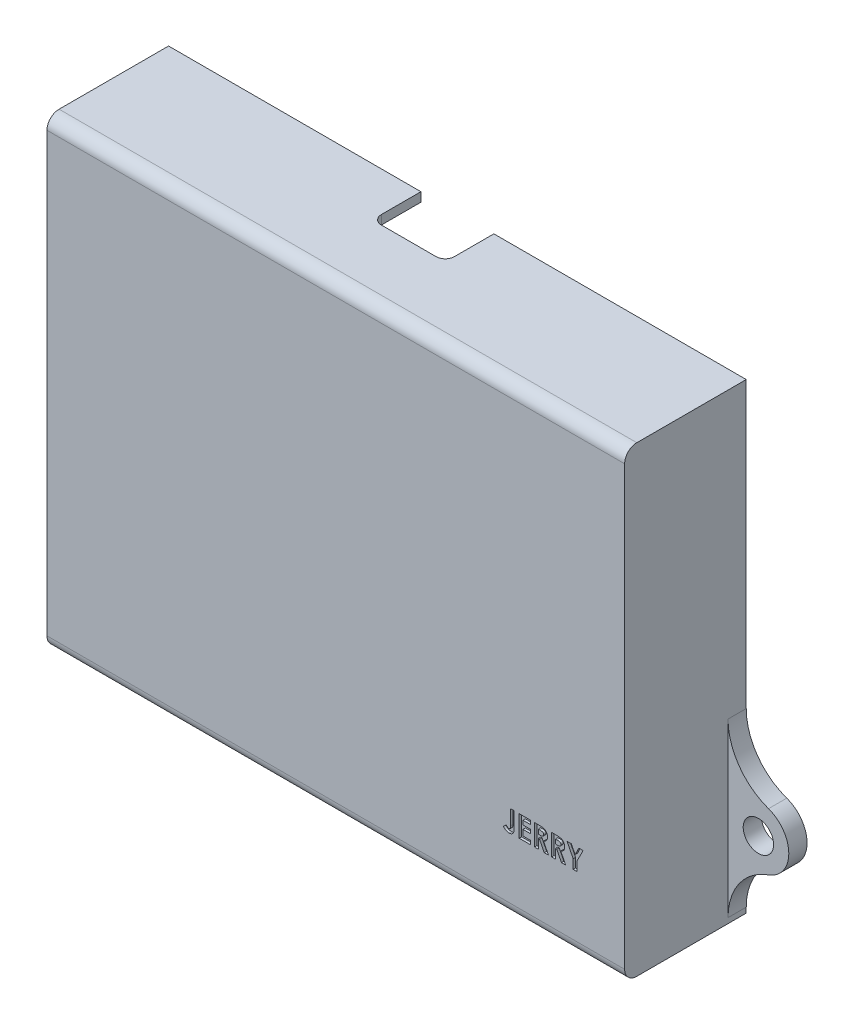
from build123d import *

# Parameters (mm, degrees)
SKETCH3_R             = 2.5
BOSS_EXTRUDE1_DEPTH   = 3
SKETCH3_R_2           = 3.85
BOSS_EXTRUDE1_2_DEPTH = 3
BOSS_EXTRUDE2_DEPTH   = 20
BOSS_EXTRUDE3_START   = 20
SKETCH3_4_W           = 84
SKETCH3_4_H           = 70
SKETCH3_4_W_2         = 8
SKETCH3_4_R           = 2.35
BOSS_EXTRUDE3_DEPTH   = 1.5
FILLET1_R             = 2
SKETCH4_W             = 30
SKETCH4_H             = 8
CUT_EXTRUDE1_DEPTH    = 4.5
CUT_EXTRUDE2_DEPTH    = 1.5
SKETCH6_W             = 12
SKETCH6_H             = 8
CUT_EXTRUDE3_DEPTH    = 1.5
FILLET2_R             = 1.5
CUT_EXTRUDE4_DEPTH    = 0.4


with BuildPart() as part:
    # Sketch3 → Boss-Extrude1 (new body)
    with BuildSketch(Plane.XY):
        with BuildLine():
            ThreePointArc((54.166666667, 20.285954792), (49.335034191, 16.631367068), (47.5, 10.857864376))
            Line((47.5, 10.857864376), (47.5, 39.142135624))
            ThreePointArc((47.5, 39.142135624), (49.335034191, 33.368632932), (54.166666667, 29.714045208))
            ThreePointArc((54.166666667, 29.714045208), (57.5, 25), (54.166666667, 20.285954792))
        make_face()
        with Locations((52.5, 25)):
            Circle(SKETCH3_R, mode=Mode.SUBTRACT)
    extrude(amount=BOSS_EXTRUDE1_DEPTH)



with BuildPart() as body_2:
    # Sketch3 → Boss-Extrude1 2 (new body)
    with BuildSketch(Plane.XY):
        with BuildLine():
            Line((-47.5, 39.142135624), (-47.5, 10.857864376))
            ThreePointArc((-47.5, 10.857864376), (-49.335034191, 16.631367068), (-54.166666667, 20.285954792))
            ThreePointArc((-54.166666667, 20.285954792), (-57.5, 25), (-54.166666667, 29.714045208))
            ThreePointArc((-54.166666667, 29.714045208), (-49.335034191, 33.368632932), (-47.5, 39.142135624))
        make_face()
        with Locations((-52.5, 25)):
            Circle(SKETCH3_R_2, mode=Mode.SUBTRACT)
    extrude(amount=BOSS_EXTRUDE1_2_DEPTH)


with BuildPart() as part_1:
    add(part.part)

    add(body_2.part)  # Boss-Extrude2 merges body 2
    # Sketch3<3> → Boss-Extrude2 (add)
    with BuildSketch(Plane.XY):
        Polygon((-38, 86), (-47.5, 86), (-47.5, 39.142135624), (-47.5, 10.857864376), (-47.5, 10), (-38, 10), (-38, 14.5), (-46, 14.5), (-46, 84.5), (-38, 84.5), align=None)
        Polygon((47.5, 86), (-38, 86), (-38, 84.5), (46, 84.5), (46, 14.5), (-38, 14.5), (-38, 10), (47.5, 10), (47.5, 10.857864376), (47.5, 39.142135624), align=None)
    extrude(amount=BOSS_EXTRUDE2_DEPTH)

    # Sketch3<4> → Boss-Extrude3 (add)
    # profile 1 of 4: a face of its own
    with BuildSketch(Plane.XY.offset(BOSS_EXTRUDE3_START)):
        with Locations((4, 49.5)):
            Rectangle(SKETCH3_4_W, SKETCH3_4_H)
    # profile 2 of 4: a face of its own
    with BuildSketch(Plane.XY.offset(BOSS_EXTRUDE3_START)):
        with Locations((-42, 49.5)):
            Rectangle(SKETCH3_4_W_2, SKETCH3_4_H)
        with Locations((-41.5, 21)):
            Circle(SKETCH3_4_R, mode=Mode.SUBTRACT)
        with Locations((-41.5, 79)):
            Circle(SKETCH3_4_R, mode=Mode.SUBTRACT)
    # profile 3 of 4: a face of its own
    with BuildSketch(Plane.XY.offset(BOSS_EXTRUDE3_START)):
        with Locations((-41.5, 79)):
            Circle(SKETCH3_4_R)
    # profile 4 of 4: a face of its own
    with BuildSketch(Plane.XY.offset(BOSS_EXTRUDE3_START)):
        with Locations((-41.5, 21)):
            Circle(SKETCH3_4_R)
    extrude(amount=-BOSS_EXTRUDE3_DEPTH)

    # Fillet1
    fillet1_edges = [part_1.edges().sort_by_distance(p)[0] for p in [
        (0, 86, 20),
        (0, 10, 20),
        (0, 84.5, 18.5),
        (0, 14.5, 18.5),
    ]]
    fillet(fillet1_edges, radius=FILLET1_R)

    # Sketch4 → Cut-Extrude1 (cut)
    with BuildSketch(Plane.XZ.offset(-10)):
        with Locations((-17.5, 4)):
            Rectangle(SKETCH4_W, SKETCH4_H)
        with BuildLine():
            ThreePointArc((34, 5), (31.25, 7.75), (28.5, 5))
            Line((28.5, 5), (34, 5))
        make_face()
        with BuildLine():
            Line((34, 5), (28.5, 5))
            ThreePointArc((28.5, 5), (31.25, 2.25), (34, 5))
        make_face()
        with BuildLine():
            Line((28.5, 5), (28.5, 0))
            Line((28.5, 0), (34, 0))
            Line((34, 0), (34, 5))
            ThreePointArc((34, 5), (31.25, 2.25), (28.5, 5))
        make_face()
    extrude(amount=-CUT_EXTRUDE1_DEPTH, mode=Mode.SUBTRACT)

    # Sketch5 → Cut-Extrude2 (cut)
    with BuildSketch(Plane.ZY.offset(47.5)):
        with BuildLine():
            Line((18.5, 69), (18.5, 63))
            ThreePointArc((18.5, 63), (14.5, 59), (10.5, 63))
            Line((10.5, 63), (10.5, 69))
            ThreePointArc((10.5, 69), (14.5, 73), (18.5, 69))
        make_face()
    extrude(amount=-CUT_EXTRUDE2_DEPTH, mode=Mode.SUBTRACT)

    # Sketch6 → Cut-Extrude3 (cut)
    with BuildSketch(Plane(origin=(0, 86, 0), x_dir=(1, 0, 0), z_dir=(0, 1, 0))):
        with Locations((0, -4)):
            Rectangle(SKETCH6_W, SKETCH6_H)
    extrude(amount=-CUT_EXTRUDE3_DEPTH, mode=Mode.SUBTRACT)

    # Fillet2
    fillet2_edges = [part_1.edges().sort_by_distance(p)[0] for p in [
        (-2.5, 12.25, 8),
        (-32.5, 12.25, 8),
        (6, 85.25, 8),
        (-6, 85.25, 8),
    ]]
    fillet(fillet2_edges, radius=FILLET2_R)

    # Sketch7 → Cut-Extrude4 (cut)
    # profile 1 of 5: a face of its own
    with BuildSketch(Plane.XY.offset(20)):
        with BuildLine():
            add(Edge.make_bspline(
                [(28.509381677, 22.538461538), (28.541495818, 22.537509824), (28.5895362, 22.549097989), (28.640224409, 22.589142925), (28.664850082, 22.62285843), (28.68054554, 22.657385024), (28.690352064, 22.690749985), (28.699657906, 22.730749048), (28.707116873, 22.77735798), (28.712737632, 22.831186642), (28.716778989, 22.916329879), (28.719922264, 22.983618221), (28.719017094, 23.030649038)],
                knots=[0, 0, 0, 0, 0.160851851, 0.236744462, 0.319647799, 0.367325512, 0.426209549, 0.49352409, 0.573025278, 0.662506021, 0.764543202, 1, 1, 1, 1], degree=3))
            Line((28.719017094, 23.030649038), (28.719017094, 25.5))
            Line((28.719017094, 25.5), (29.347222222, 25.5))
            Line((29.347222222, 25.5), (29.347222222, 23.176482372))
            add(Edge.make_bspline(
                [(29.347222222, 23.176482372), (29.347455674, 23.090913082), (29.344516938, 22.967667506), (29.336089066, 22.810380364), (29.327447557, 22.707862094), (29.314595031, 22.615772505), (29.300053064, 22.533881782), (29.284008532, 22.461856269), (29.256905605, 22.381248472), (29.214829062, 22.291984763), (29.151334267, 22.195566151), (29.07226333, 22.111798865), (28.981198191, 22.03902186), (28.877378769, 21.981454295), (28.72143518, 21.924338191), (28.594454256, 21.910691147), (28.508680556, 21.91025641)],
                knots=[0, 0, 0, 0, 0.147218026, 0.212058994, 0.27099949, 0.324170993, 0.371969815, 0.41410523, 0.450981256, 0.518077209, 0.583319666, 0.648756383, 0.715449883, 0.783134877, 0.852084922, 1, 1, 1, 1], degree=3))
            add(Edge.make_bspline(
                [(28.508680556, 21.91025641), (28.417705229, 21.91011192), (28.282324971, 21.924967227), (28.109762563, 21.977027681), (27.98731656, 22.032592154), (27.869097804, 22.102330244), (27.716209337, 22.220036632), (27.614033102, 22.326997762), (27.552350427, 22.405949519)],
                knots=[0, 0, 0, 0, 0.244326122, 0.363091916, 0.482806411, 0.604690739, 0.731012015, 1, 1, 1, 1], degree=3))
            Line((27.552350427, 22.405949519), (28.027711004, 22.845552885))
            add(Edge.make_bspline(
                [(28.027711004, 22.845552885), (28.073538083, 22.792254126), (28.140951393, 22.72073773), (28.232680685, 22.640910826), (28.292354907, 22.601098682), (28.34867639, 22.573077756), (28.419147589, 22.546666445), (28.473944779, 22.539347588), (28.509381677, 22.538461538)],
                knots=[0, 0, 0, 0, 0.357765522, 0.499586074, 0.618044673, 0.721795542, 0.819272161, 1, 1, 1, 1], degree=3))
        make_face()
    # profile 2 of 5: a face of its own
    with BuildSketch(Plane.XY.offset(20)):
        Polygon((30.15491453, 22), (30.15491453, 25.5), (32.039529915, 25.5), (32.039529915, 24.871794872), (30.783119658, 24.871794872), (30.783119658, 24.198717949), (32.039529915, 24.198717949), (32.039529915, 23.570512821), (30.783119658, 23.570512821), (30.783119658, 22.628205128), (32.039529915, 22.628205128), (32.039529915, 22), align=None)
    # profile 3 of 5: a face of its own
    with BuildSketch(Plane.XY.offset(20)):
        with BuildLine():
            add(Edge.make_bspline(
                [(34.821581197, 24.505809295), (34.820747165, 24.451748535), (34.817367754, 24.371926124), (34.80043559, 24.268622148), (34.781614831, 24.196254889), (34.759971632, 24.126647191), (34.731194992, 24.061084491), (34.698716966, 23.998612988), (34.660143978, 23.940116407), (34.61781192, 23.884295533), (34.568580783, 23.833288588), (34.515639317, 23.784356031), (34.456014074, 23.740555672), (34.392323503, 23.69895437), (34.298461171, 23.647537253), (34.223224491, 23.615571181), (34.170940171, 23.597155449)],
                knots=[0, 0, 0, 0, 0.134789088, 0.19853605, 0.260385651, 0.320961578, 0.37990385, 0.438502936, 0.496154344, 0.554265483, 0.612748761, 0.672513443, 0.733646402, 0.796789619, 0.861935699, 1, 1, 1, 1], degree=3))
            Line((34.170940171, 23.597155449), (34.978632479, 22))
            Line((34.978632479, 22), (34.280315171, 22))
            Line((34.280315171, 22), (33.509081197, 23.525641026))
            Line((33.509081197, 23.525641026), (33.295940171, 23.525641026))
            Line((33.295940171, 23.525641026), (33.295940171, 22))
            Line((33.295940171, 22), (32.667735043, 22))
            Line((32.667735043, 22), (32.667735043, 25.5))
            Line((32.667735043, 25.5), (33.399706197, 25.5))
            add(Edge.make_bspline(
                [(33.399706197, 25.5), (33.492764341, 25.500504878), (33.627021118, 25.497194109), (33.798584701, 25.487024878), (33.911112139, 25.475971417), (34.012856714, 25.461295974), (34.103920486, 25.444000235), (34.184300773, 25.424287102), (34.254675478, 25.399723208), (34.318185168, 25.372015462), (34.377385029, 25.340178764), (34.433581098, 25.304567615), (34.486397764, 25.264244991), (34.536294017, 25.219936286), (34.583363991, 25.171596899), (34.626942531, 25.118816932), (34.666759852, 25.061929888), (34.703049966, 25.002086018), (34.735123445, 24.939203174), (34.761203306, 24.873237558), (34.784256693, 24.805142775), (34.800827976, 24.733944397), (34.816613487, 24.634235537), (34.822564685, 24.557660809), (34.821581197, 24.505809295)],
                knots=[0, 0, 0, 0, 0.14018613, 0.202277434, 0.258895132, 0.310482942, 0.357095244, 0.398513567, 0.435037511, 0.469251486, 0.502805028, 0.536210446, 0.56937936, 0.602801475, 0.636665798, 0.670928657, 0.705803, 0.741189061, 0.776304311, 0.812004301, 0.847968976, 0.884521761, 0.921974159, 1, 1, 1, 1], degree=3))
        make_face()
        with BuildLine():
            add(Edge.make_bspline(
                [(34.193376068, 24.514222756), (34.193795278, 24.550600021), (34.185230837, 24.604743812), (34.155237289, 24.67021572), (34.124969472, 24.714641951), (34.086794476, 24.753590431), (34.043000092, 24.787923446), (33.992624573, 24.815071522), (33.945981558, 24.832978078), (33.903547103, 24.843691767), (33.865251381, 24.851675488), (33.820904701, 24.85733389), (33.770473551, 24.863335111), (33.714086685, 24.867228743), (33.62645215, 24.871190241), (33.557686709, 24.871296288), (33.509782318, 24.871794872)],
                knots=[0, 0, 0, 0, 0.125262305, 0.185413583, 0.246806762, 0.309422389, 0.372532682, 0.437733251, 0.505749517, 0.544013263, 0.588369599, 0.640389019, 0.697897401, 0.763271619, 0.834978604, 1, 1, 1, 1], degree=3))
            Line((33.509782318, 24.871794872), (33.295940171, 24.871794872))
            Line((33.295940171, 24.871794872), (33.295940171, 24.153846154))
            Line((33.295940171, 24.153846154), (33.540631677, 24.153846154))
            add(Edge.make_bspline(
                [(33.540631677, 24.153846154), (33.597871592, 24.154683748), (33.680408184, 24.154964155), (33.785028194, 24.165028724), (33.852609334, 24.174141578), (33.913293391, 24.184659744), (33.966538152, 24.199734), (34.013164245, 24.215886252), (34.052619124, 24.235959364), (34.086328407, 24.258786825), (34.115434427, 24.284719428), (34.139508515, 24.314732977), (34.159325599, 24.348012458), (34.17473, 24.384849793), (34.190287115, 24.439978878), (34.193192869, 24.484218545), (34.193376068, 24.514222756)],
                knots=[0, 0, 0, 0, 0.202086415, 0.290684899, 0.37055261, 0.442670262, 0.507674928, 0.565573203, 0.616454666, 0.663331357, 0.708862024, 0.7534118, 0.798515011, 0.845064321, 0.893873119, 1, 1, 1, 1], degree=3))
        make_face(mode=Mode.SUBTRACT)
    # profile 4 of 5: a face of its own
    with BuildSketch(Plane.XY.offset(20)):
        with BuildLine():
            add(Edge.make_bspline(
                [(37.648504274, 24.505809295), (37.647670242, 24.451748535), (37.644290831, 24.371926124), (37.627358667, 24.268622148), (37.608537908, 24.196254889), (37.586894709, 24.126647191), (37.558118069, 24.061084491), (37.525640043, 23.998612988), (37.487067055, 23.940116407), (37.444734997, 23.884295533), (37.39550386, 23.833288588), (37.342562394, 23.784356031), (37.282937151, 23.740555672), (37.21924658, 23.69895437), (37.125384248, 23.647537253), (37.050147568, 23.615571181), (36.997863248, 23.597155449)],
                knots=[0, 0, 0, 0, 0.134789088, 0.19853605, 0.260385651, 0.320961578, 0.37990385, 0.438502936, 0.496154344, 0.554265483, 0.612748761, 0.672513443, 0.733646402, 0.796789619, 0.861935699, 1, 1, 1, 1], degree=3))
            Line((36.997863248, 23.597155449), (37.805555556, 22))
            Line((37.805555556, 22), (37.107238248, 22))
            Line((37.107238248, 22), (36.336004274, 23.525641026))
            Line((36.336004274, 23.525641026), (36.122863248, 23.525641026))
            Line((36.122863248, 23.525641026), (36.122863248, 22))
            Line((36.122863248, 22), (35.49465812, 22))
            Line((35.49465812, 22), (35.49465812, 25.5))
            Line((35.49465812, 25.5), (36.226629274, 25.5))
            add(Edge.make_bspline(
                [(36.226629274, 25.5), (36.319687418, 25.500504878), (36.453944195, 25.497194109), (36.625507778, 25.487024878), (36.738035216, 25.475971417), (36.839779791, 25.461295974), (36.930843563, 25.444000235), (37.01122385, 25.424287102), (37.081598555, 25.399723208), (37.145108245, 25.372015462), (37.204308106, 25.340178764), (37.260504175, 25.304567615), (37.313320841, 25.264244991), (37.363217094, 25.219936286), (37.410287068, 25.171596899), (37.453865608, 25.118816932), (37.493682929, 25.061929888), (37.529973043, 25.002086018), (37.562046522, 24.939203174), (37.588126383, 24.873237558), (37.611179769, 24.805142775), (37.627751053, 24.733944397), (37.643536564, 24.634235537), (37.649487762, 24.557660809), (37.648504274, 24.505809295)],
                knots=[0, 0, 0, 0, 0.14018613, 0.202277434, 0.258895132, 0.310482942, 0.357095244, 0.398513567, 0.435037511, 0.469251486, 0.502805028, 0.536210446, 0.56937936, 0.602801475, 0.636665798, 0.670928657, 0.705803, 0.741189061, 0.776304311, 0.812004301, 0.847968976, 0.884521761, 0.921974159, 1, 1, 1, 1], degree=3))
        make_face()
        with BuildLine():
            add(Edge.make_bspline(
                [(37.020299145, 24.514222756), (37.020718355, 24.550600021), (37.012153914, 24.604743812), (36.982160366, 24.67021572), (36.951892549, 24.714641951), (36.913717553, 24.753590431), (36.869923169, 24.787923446), (36.81954765, 24.815071522), (36.772904635, 24.832978078), (36.73047018, 24.843691767), (36.692174458, 24.851675488), (36.647827778, 24.85733389), (36.597396628, 24.863335111), (36.541009762, 24.867228743), (36.453375227, 24.871190241), (36.384609786, 24.871296288), (36.336705395, 24.871794872)],
                knots=[0, 0, 0, 0, 0.125262305, 0.185413583, 0.246806762, 0.309422389, 0.372532682, 0.437733251, 0.505749517, 0.544013263, 0.588369599, 0.640389019, 0.697897401, 0.763271619, 0.834978604, 1, 1, 1, 1], degree=3))
            Line((36.336705395, 24.871794872), (36.122863248, 24.871794872))
            Line((36.122863248, 24.871794872), (36.122863248, 24.153846154))
            Line((36.122863248, 24.153846154), (36.367554754, 24.153846154))
            add(Edge.make_bspline(
                [(36.367554754, 24.153846154), (36.424794669, 24.154683748), (36.507331261, 24.154964155), (36.611951271, 24.165028724), (36.67953241, 24.174141578), (36.740216468, 24.184659744), (36.793461229, 24.199734), (36.840087322, 24.215886252), (36.8795422, 24.235959364), (36.913251484, 24.258786825), (36.942357504, 24.284719428), (36.966431591, 24.314732977), (36.986248676, 24.348012458), (37.001653076, 24.384849793), (37.017210192, 24.439978878), (37.020115946, 24.484218545), (37.020299145, 24.514222756)],
                knots=[0, 0, 0, 0, 0.202086415, 0.290684899, 0.37055261, 0.442670262, 0.507674928, 0.565573203, 0.616454666, 0.663331357, 0.708862024, 0.7534118, 0.798515011, 0.845064321, 0.893873119, 1, 1, 1, 1], degree=3))
        make_face(mode=Mode.SUBTRACT)
    # profile 5 of 5: a face of its own
    with BuildSketch(Plane.XY.offset(20)):
        Polygon((39.039529915, 23.515825321), (38.02991453, 25.5), (38.728932959, 25.5), (39.353632479, 24.271634615), (39.979734241, 25.5), (40.677350427, 25.5), (39.667735043, 23.515825321), (39.667735043, 22), (39.039529915, 22), align=None)
    extrude(amount=-CUT_EXTRUDE4_DEPTH, mode=Mode.SUBTRACT)


solid = part_1.part
